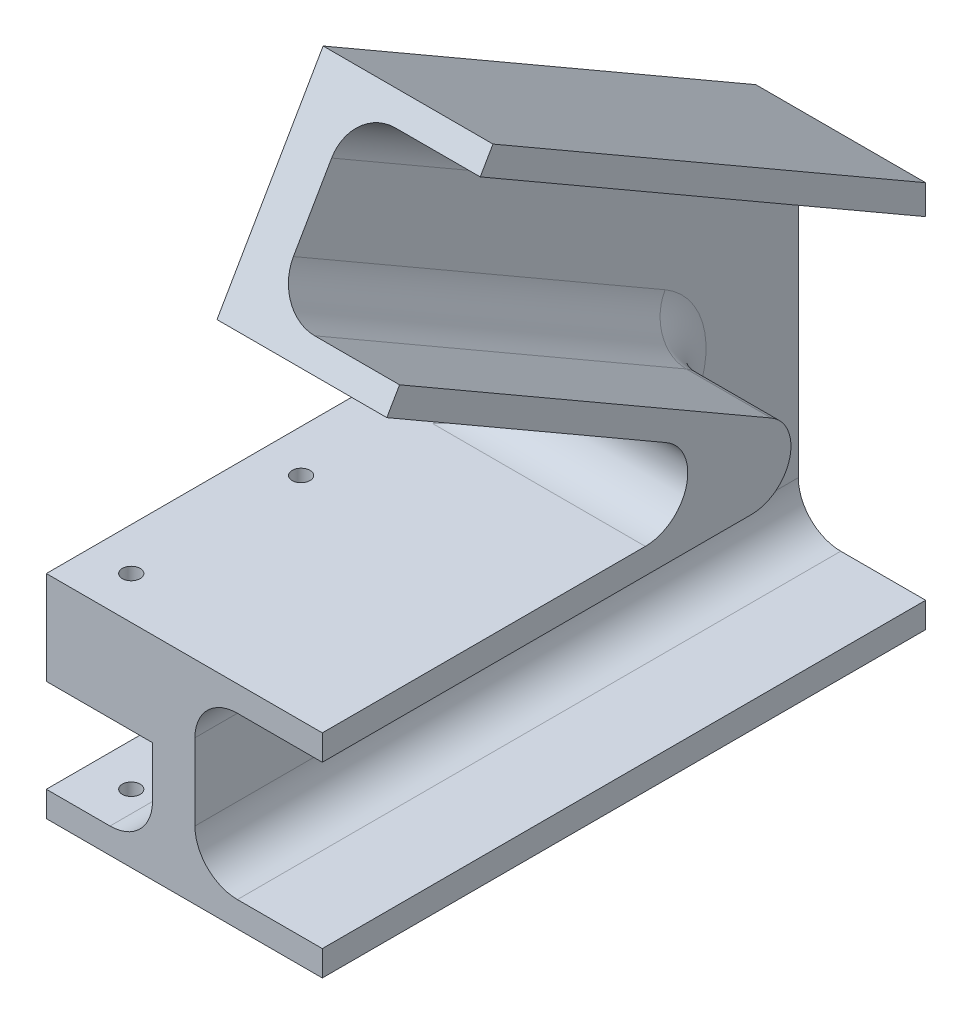
from build123d import *

# Parameters (mm, degrees)
EXTRUDE_1_DEPTH     = 40
EXTRUDE_1_2_DEPTH   = 40
EXTRUDE_2_DEPTH     = 10
EXTRUDE_4_DEPTH     = 25
EXTRUDE_5_DEPTH     = 25
FILLET_4_R          = 10
FILLET_5_R          = 10
FILLET_6_R          = 10
FILLET_7_R          = 10
CUT_EXTRUDE_1_DEPTH = 30
FILLET_11_R         = 10
SKETCH_5_R          = 2.099999999999999
SKETCH_5_R_2        = 2.0999999999999983
SKETCH_5_R_3        = 2.1
SKETCH_5_R_4        = 2.0999999999999965
CUT_EXTRUDE_2_DEPTH = 255.61889299989065
CUT_EXTRUDE_3_DEPTH = 255.61889299989065
CUT_EXTRUDE_4_DEPTH = 240.0365573985137
EXTRUDE_6_DEPTH     = 16
SKETCH_5_2_R        = 2.099999999999999
SKETCH_5_2_R_2      = 2.0999999999999983
SKETCH_5_2_R_3      = 2.1
SKETCH_5_2_R_4      = 2.0999999999999965
CUT_EXTRUDE_5_DEPTH = 179.3042624280185


with BuildPart() as part:
    # 草图1 → 凸台-拉伸1 (new body)
    with BuildSketch(Plane(origin=(0, 0, 0), x_dir=(0, 0, -1), z_dir=(1, 0, 0))):
        Polygon((113.39745962155384, 1.22e-15), (0, 0), (0, -6), (135.7897644669674, -5.999999999999998), (18.192378864667774, 61.89488223348293), (15.192378864667806, 56.69872981077631), align=None)
    extrude(amount=EXTRUDE_1_DEPTH)



with BuildPart() as body_2:
    # 草图1 → Extrude 1 2 (new body)
    with BuildSketch(Plane(origin=(0, 0, 0), x_dir=(0, 0, -1), z_dir=(1, 0, 0))):
        Polygon((0, -44.00000000000001), (0, -50), (230.71796769724395, -50), (230.71796769724395, -10), (40.192378864667546, 99.99999999999838), (37.19237886466758, 94.80384757729173), (224.71796769724395, -13.464101615137764), (224.71796769724395, -44.00000000000001), align=None)
    extrude(amount=EXTRUDE_1_2_DEPTH)


with BuildPart() as part_1:
    add(part.part)

    add(body_2.part)  # 凸台-拉伸2 merges body 2
    # 草图1<6> → 凸台-拉伸2 (add)
    with BuildSketch(Plane(origin=(0, 0, 0), x_dir=(0, 0, -1), z_dir=(1, 0, 0))):
        Polygon((6, -6), (0, -6), (0, -44.00000000000001), (6.000000000000005, -44.00000000000001), (224.71796769724395, -44.00000000000001), (224.71796769724395, -13.464101615137768), (42.388531287374235, 91.80384757729178), (37.192378864667575, 94.80384757729173), (18.192378864667766, 61.89488223348294), (23.38853128737442, 58.89488223348298), (135.7897644669674, -5.999999999999998), align=None)
    extrude(amount=EXTRUDE_2_DEPTH)

    # 草图1<9> → 凸台-拉伸4 (add)
    with BuildSketch(Plane(origin=(0, 0, 0), x_dir=(0, 0, -1), z_dir=(1, 0, 0))):
        Polygon((6.000000000000005, -44.00000000000001), (5.33e-15, -44.00000000000001), (0, -50), (224.71796769724395, -50), (224.71796769724395, -44.00000000000001), align=None)
    extrude(amount=-EXTRUDE_4_DEPTH)

    # 草图2 → 凸台-拉伸5 (add)
    with BuildSketch(Plane.ZY):
        Polygon((0, 0), (-213.3974596215552, -2.429e-14), (-223.78976446696848, -6.0000000000000275), (0, -6), align=None)
    extrude(amount=EXTRUDE_5_DEPTH)

    # 圆角4
    fillet_4_edges = [part_1.edges().sort_by_distance(p)[0] for p in [
        (0, -1.86e-14, -163.39745962155453),
        (20, 1.22e-15, -113.39745962155384),
    ]]
    fillet(fillet_4_edges, radius=FILLET_4_R)

    # 圆角5
    fillet_5_edges = [part_1.edges().sort_by_distance(p)[0] for p in [
        (0, -44.00000000000001, -112.35898384862197),
        (0, -6.000000000000014, -111.89488223348424),
    ]]
    fillet(fillet_5_edges, radius=FILLET_5_R)

    # 圆角6
    fillet_6_edges = [part_1.edges().sort_by_distance(p)[0] for p in [
        (25, -44.00000000000001, -224.71796769724395),
        (25, -13.464101615137766, -224.71796769724395),
    ]]
    fillet(fillet_6_edges, radius=FILLET_6_R)

    # 圆角7
    fillet_7_edges = [part_1.edges().sort_by_distance(p)[0] for p in [
        (18.999999999999993, -10, -230.71796769724395),
    ]]
    fillet(fillet_7_edges, radius=FILLET_7_R)

    # 草图3 → 切除-拉伸1 (cut)
    with BuildSketch(Plane(origin=(40, 0, 0), x_dir=(0, 0, -1), z_dir=(1, 0, 0))):
        with BuildLine():
            Line((101.0769515458646, -5.999999999999998), (135.7897644669674, -5.999999999999998))
            Line((135.7897644669674, -5.999999999999998), (105.72758664047566, 11.356406460551396))
            ThreePointArc((105.72758664047566, 11.356406460551396), (110.06128863892687, 0.8939243206071232), (101.0769515458646, -5.999999999999998))
        make_face()
    extrude(amount=-CUT_EXTRUDE_1_DEPTH, mode=Mode.SUBTRACT)

    # 圆角11
    fillet_11_edges = [part_1.edges().sort_by_distance(p)[0] for p in [
        (10, 36.62564434701707, -61.95998275257166),
        (10, 0.8939243206071223, -110.06128863892687),
        (10, -44.00000000000001, -107.35898384862197),
        (10, -41.07106781186548, -221.78903550910942),
        (10, -26.618802153517038, -224.71796769724395),
        (10, -14.237604307034038, -223.37822173508832),
        (10, -5.999999999999999, -50.5384757729323),
        (10, 42.11324865405104, -128.45517328095573),
    ]]
    fillet(fillet_11_edges, radius=FILLET_11_R)

    # 草图5 → 切除-拉伸2 (cut, through all)
    with BuildSketch(Plane(origin=(0, 0, 0), x_dir=(1, 0, 0), z_dir=(0, 1, 1e-17))):
        with Locations((-15.000000000000002, 10)):
            Circle(SKETCH_5_R)
        with Locations((-15.000000000000139, 50)):
            Circle(SKETCH_5_R_2)
        with Locations((-15.000000000000275, 90)):
            Circle(SKETCH_5_R_3)
        with Locations((-15.000000000000412, 130)):
            Circle(SKETCH_5_R_4)
    extrude(amount=-CUT_EXTRUDE_2_DEPTH, mode=Mode.SUBTRACT)

    # 草图6 → 切除-拉伸3 (cut, through all)
    with BuildSketch(Plane(origin=(0, 0, 0), x_dir=(1, 0, 0), z_dir=(0, 1, 1e-17))):
        Polygon((-25, 231.5180230769059), (40, 231.5180230769059), (40.00000000000001, 142.1), (-24.99999999999999, 142.1), align=None)
    extrude(amount=-CUT_EXTRUDE_3_DEPTH, mode=Mode.SUBTRACT)

    # 草图6<2> → 切除-拉伸4 (cut, through all)
    with BuildSketch(Plane(origin=(0, 0, 0), x_dir=(1, 0, 0), z_dir=(0, 1, 1e-17))):
        Polygon((-25, 231.5180230769059), (40, 231.5180230769059), (40.00000000000001, 142.1), (-24.99999999999999, 142.1), align=None)
    extrude(amount=CUT_EXTRUDE_4_DEPTH, mode=Mode.SUBTRACT)

    # 草图8 → 凸台-拉伸6 (add)
    with BuildSketch(Plane.XZ.offset(6)):
        Polygon((-25, -7.4e-16), (-24.99999999999999, -142.1), (0, -142.1), (0, 0), align=None)
    extrude(amount=EXTRUDE_6_DEPTH)

    # 草图5<2> → 切除-拉伸5 (cut, through all)
    with BuildSketch(Plane(origin=(0, 0, 0), x_dir=(1, 0, 0), z_dir=(0, 1, 1e-17))):
        with Locations((-15.000000000000002, 10)):
            Circle(SKETCH_5_2_R)
        with Locations((-15.000000000000139, 50)):
            Circle(SKETCH_5_2_R_2)
        with Locations((-15.000000000000275, 90)):
            Circle(SKETCH_5_2_R_3)
        with Locations((-15.000000000000412, 130)):
            Circle(SKETCH_5_2_R_4)
    extrude(amount=-CUT_EXTRUDE_5_DEPTH, mode=Mode.SUBTRACT)


solid = part_1.part
